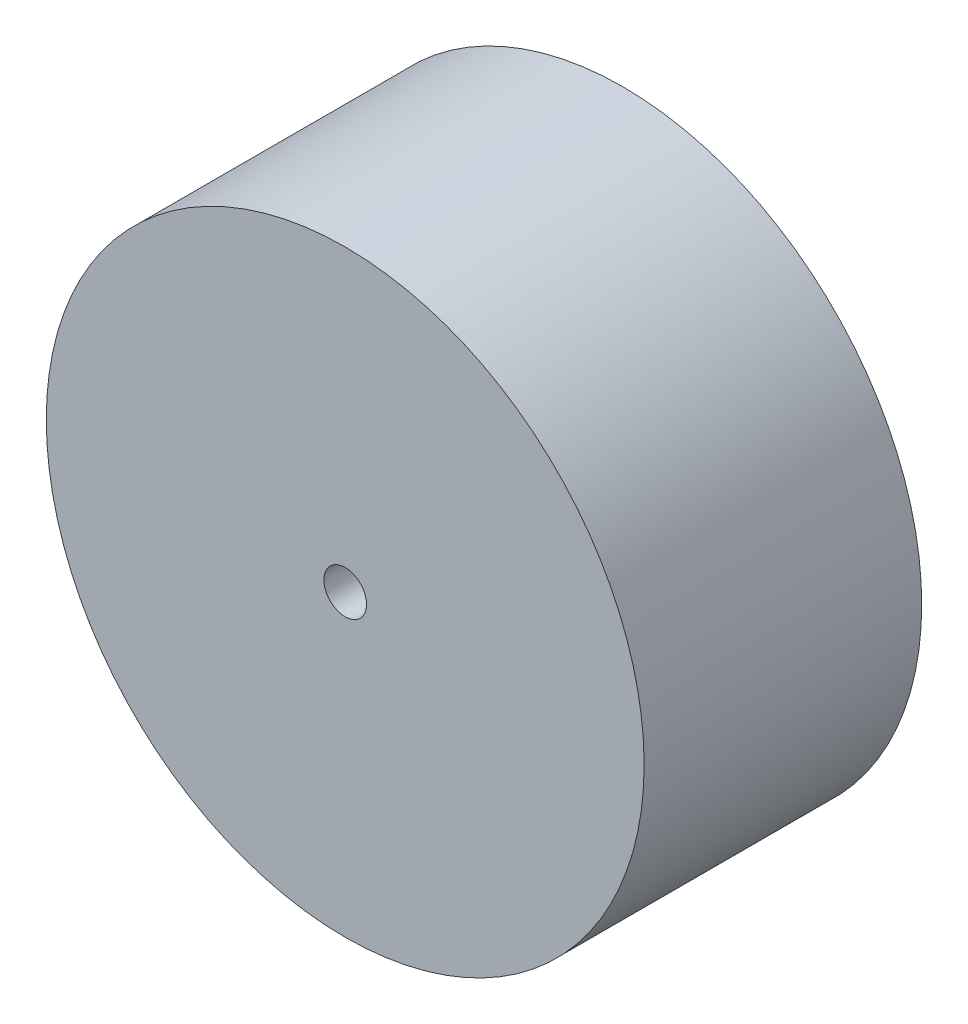
from build123d import *

# Parameters (mm, degrees)
SKETCH1_R           = 28
BOSS_EXTRUDE1_DEPTH = 26
SKETCH2_R           = 2
CUT_EXTRUDE1_DEPTH  = 26


with BuildPart() as part:
    # Sketch1 → Boss-Extrude1 (new body)
    with BuildSketch(Plane.XY):
        with Locations(Location((0, 0, 0), (0, 0, 180))):
            Circle(SKETCH1_R)
    extrude(amount=BOSS_EXTRUDE1_DEPTH)

    # Sketch2 → Cut-Extrude1 (cut)
    with BuildSketch(Plane.XY.offset(26)):
        Circle(SKETCH2_R)
    extrude(amount=-CUT_EXTRUDE1_DEPTH, mode=Mode.SUBTRACT)


solid = part.part
